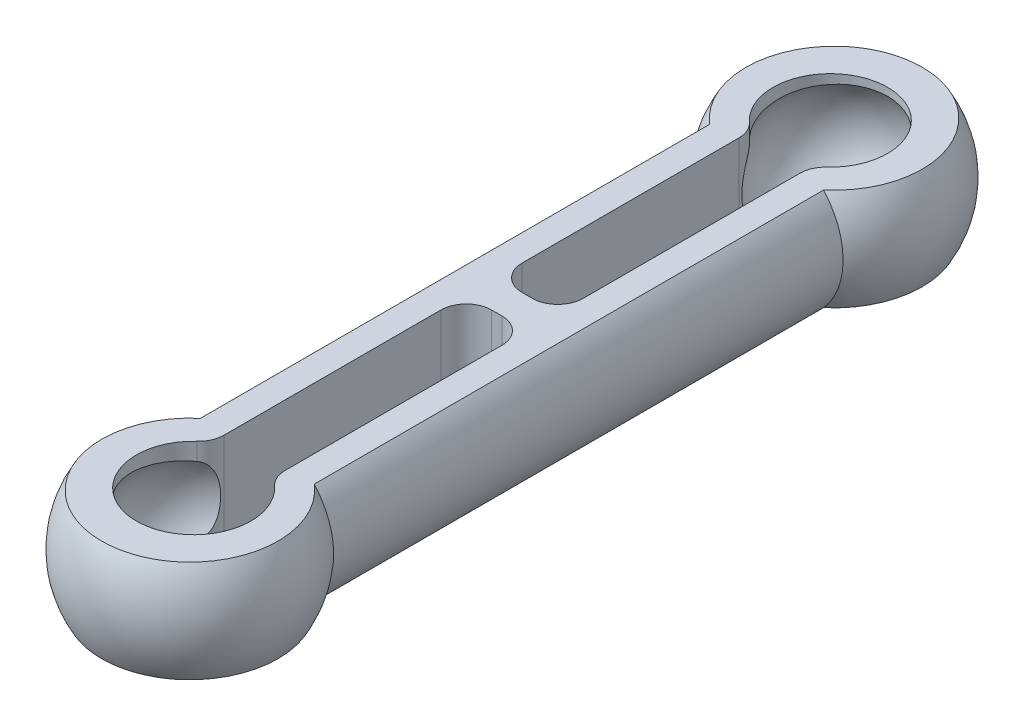
from build123d import *

# Parameters (mm, degrees)
CUT_EXTRUDE1_DEPTH = 30
CUT_EXTRUDE2_DEPTH = 30


with BuildPart() as part:
    # Sketch1 → Revolve1 (revolve)
    with BuildSketch(Plane(origin=(0, 0, 0), x_dir=(1, 0, 0), z_dir=(0, 1, 0))):
        with BuildLine():
            Line((-3, -10), (-3, 10))
            ThreePointArc((-3, 10), (-3.645751311, 14.291502622), (0, 16.645751311))
            Line((0, 16.645751311), (0, 15.345751311))
            ThreePointArc((0, 15.345751311), (-2.7, 12.645751311), (0, 9.945751311))
            Line((0, 9.945751311), (0, 8.645751311))
            Line((0, 8.645751311), (0, -8.645751311))
            Line((0, -8.645751311), (0, -9.945751311))
            ThreePointArc((0, -9.945751311), (-2.7, -12.645751311), (0, -15.345751311))
            Line((0, -15.345751311), (0, -16.645751311))
            ThreePointArc((0, -16.645751311), (-3.645751311, -14.291502622), (-3, -10))
        make_face()
    revolve(axis=Axis((0, 0, -91.394122854), (0, 0, 1)))

    # Sketch2 → Cut-Extrude1 (cut, symmetric)
    with BuildSketch(Plane(origin=(0, 0, 0), x_dir=(1, 0, 0), z_dir=(0, 1, 0))):
        with BuildLine():
            Line((-1.2, 10.107825257), (-1.2, 1.596713369))
            ThreePointArc((-1.2, 1.596713369), (-0.907106781, 0.889606588), (-0.2, 0.596713369))
            Line((-0.2, 0.596713369), (0.2, 0.596713369))
            ThreePointArc((0.2, 0.596713369), (0.907106781, 0.889606588), (1.2, 1.596713369))
            Line((1.2, 1.596713369), (1.2, 10.107825257))
            ThreePointArc((1.2, 10.107825257), (1.284324545, 10.509743733), (1.523076923, 10.843879024))
            ThreePointArc((1.523076923, 10.843879024), (0, 14.75), (-1.523076923, 10.843879024))
            ThreePointArc((-1.523076923, 10.843879024), (-1.284324545, 10.509743733), (-1.2, 10.107825257))
        make_face()
        with BuildLine():
            Line((-1.2, -10.107825257), (-1.2, -1.596713369))
            ThreePointArc((-1.2, -1.596713369), (-0.907106781, -0.889606588), (-0.2, -0.596713369))
            Line((-0.2, -0.596713369), (0.2, -0.596713369))
            ThreePointArc((0.2, -0.596713369), (0.907106781, -0.889606588), (1.2, -1.596713369))
            Line((1.2, -1.596713369), (1.2, -10.107825257))
            ThreePointArc((1.2, -10.107825257), (1.284324545, -10.509743733), (1.523076923, -10.843879024))
            ThreePointArc((1.523076923, -10.843879024), (0, -14.75), (-1.523076923, -10.843879024))
            ThreePointArc((-1.523076923, -10.843879024), (-1.284324545, -10.509743733), (-1.2, -10.107825257))
        make_face()
    extrude(amount=CUT_EXTRUDE1_DEPTH, both=True, mode=Mode.SUBTRACT)

    # Sketch3 → Cut-Extrude2 (cut, symmetric)
    with BuildSketch(Plane(origin=(0, 0, 0), x_dir=(0, 0, -1), z_dir=(1, 0, 0))):
        Polygon((0, -2), (70.025003907, -2), (70.025003907, -4), (-79.974996093, -4), (-79.974996093, -2), align=None)
        Polygon((0, 2), (70.025003907, 2), (70.025003907, 4), (-79.974996093, 4), (-79.974996093, 2), align=None)
    extrude(amount=CUT_EXTRUDE2_DEPTH, both=True, mode=Mode.SUBTRACT)


solid = part.part
